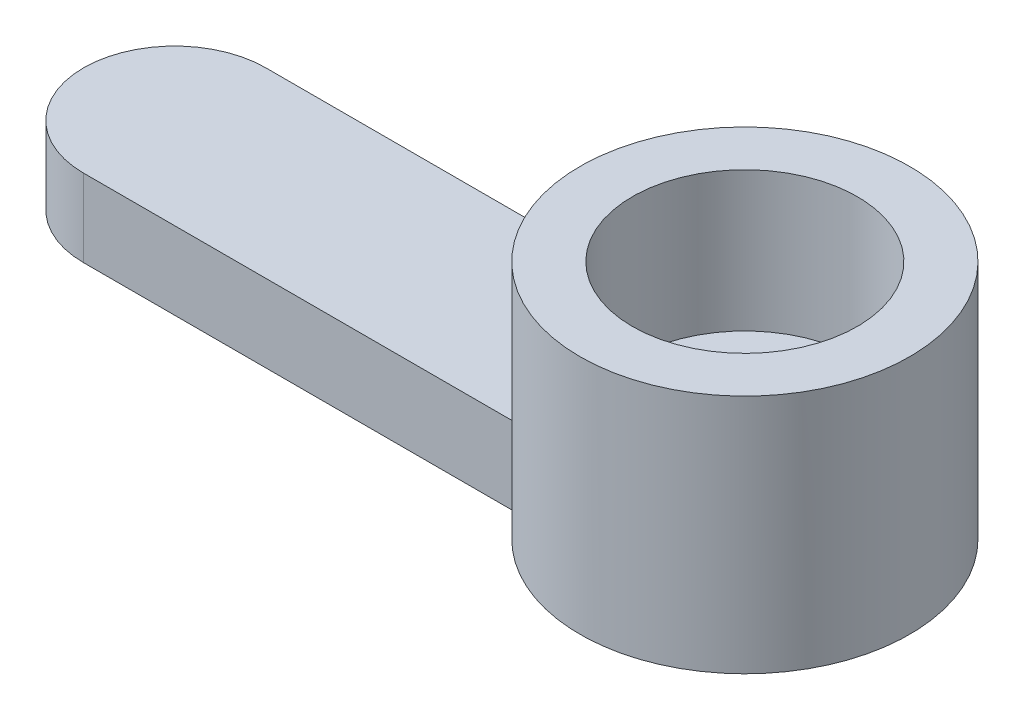
from build123d import *

# Parameters (mm, degrees)
SKETCH1_R           = 2.125
BOSS_EXTRUDE1_DEPTH = 3.1
SKETCH2_R           = 1.45
CUT_EXTRUDE1_DEPTH  = 1.8
SKETCH3_R           = 0.8
CUT_EXTRUDE2_DEPTH  = 0.65
BOSS_EXTRUDE3_DEPTH = 1


with BuildPart() as part:
    # Sketch1 → Boss-Extrude1 (new body)
    with BuildSketch(Plane(origin=(0, 0, 0), x_dir=(1, 0, 0), z_dir=(0, 1, 0))):
        with Locations(Location((0, 0, 0), (0, 0, 90))):
            Circle(SKETCH1_R)
    extrude(amount=BOSS_EXTRUDE1_DEPTH)

    # Sketch2 → Cut-Extrude1 (cut)
    with BuildSketch(Plane(origin=(0, 3.1, 0), x_dir=(1, 0, 0), z_dir=(0, 1, 0))):
        with Locations(Location((0, 0, 0), (0, 0, 270))):
            Circle(SKETCH2_R)
    extrude(amount=-CUT_EXTRUDE1_DEPTH, mode=Mode.SUBTRACT)

    # Sketch3 → Cut-Extrude2 (cut)
    with BuildSketch(Plane(origin=(0, 1.3, 0), x_dir=(1, 0, 0), z_dir=(0, 1, 0))):
        with Locations(Location((0, 0, 0), (0, 0, 270))):
            Circle(SKETCH3_R)
    extrude(amount=-CUT_EXTRUDE2_DEPTH, mode=Mode.SUBTRACT)

    # Sketch4 → Boss-Extrude3 (add)
    with BuildSketch(Plane(origin=(0, 0, 0), x_dir=(1, 0, 0), z_dir=(0, 1, 0))):
        with BuildLine():
            Line((-1.770593121, -1.175), (-7.35, -1.175))
            ThreePointArc((-7.35, -1.175), (-8.525, 0), (-7.35, 1.175))
            Line((-7.35, 1.175), (-1.770593121, 1.175))
            ThreePointArc((-1.770593121, 1.175), (-2.125, 0), (-1.770593121, -1.175))
        make_face()
    extrude(amount=BOSS_EXTRUDE3_DEPTH)


solid = part.part
